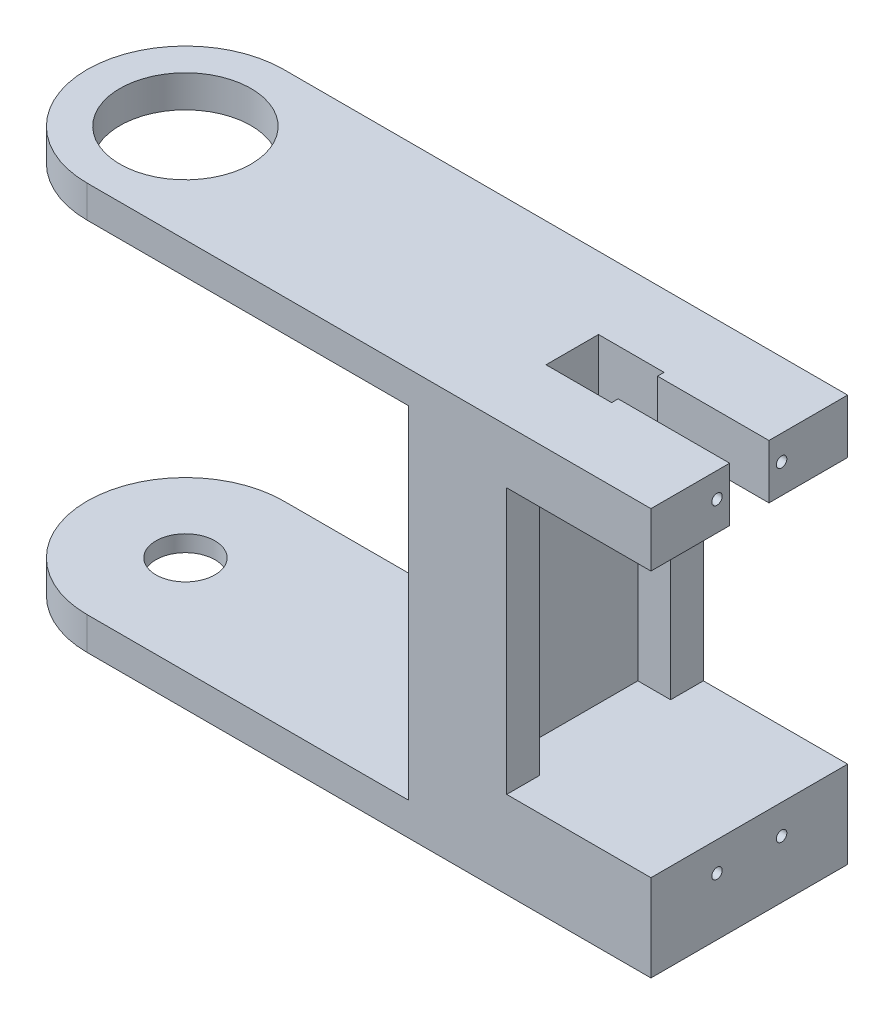
from build123d import *

# Parameters (mm, degrees)
ESQUISSE1_W               = 60.5
ESQUISSE1_H               = 64
BOSS_EXTRU_1_DEPTH        = 30
ESQUISSE2_R               = 4.5
ENL_V_MAT_EXTRU_1_DEPTH   = 32
ENL_V_MAT_EXTRU_2_REACH   = 55.283
ESQUISSE4_W               = 51.1
ESQUISSE4_H               = 83.557669167
ESQUISSE5_R               = 10.5
ENL_V_MAT_EXTRU_3_DEPTH   = 2
ESQUISSE6_R               = 10
ENL_V_MAT_EXTRU_4_DEPTH   = 4.7
ESQUISSE7_W               = 47
ESQUISSE7_H               = 57
BOSS_EXTRU_2_DEPTH        = 30
ENL_V_MAT_EXTRU_5_DEPTH   = 30
ENL_V_MAT_EXTRU_6_DEPTH   = 8.25
ESQUISSE11_W              = 5
ESQUISSE11_H              = 40.5
BOSS_EXTRU_3_DEPTH        = 5
ESQUISSE12_R              = 0.5
ENL_V_MAT_EXTRU_7_DEPTH   = 15
TROU_TARAUD_M2X0_42_D     = 1.6
TROU_TARAUD_M2X0_42_DEPTH = 17
TROU_TARAUD_M2X0_42_TIP   = 0.480688495
ENL_V_MAT_EXTRU_8_REACH   = 113.72
ESQUISSE22_W              = 82.97203866
ESQUISSE22_H              = 67.875780224
ENL_V_MAT_EXTRU_10_DEPTH  = 30
ESQUISSE23_W              = 55
ESQUISSE23_H              = 5
ESQUISSE23_H_2            = 4.9
BOSS_EXTRU_4_DEPTH        = 30
ENL_V_START               = -62
ESQUISSE24_R              = 10
ENL_V_MAT_EXTRU_11_DEPTH  = 62
ENL_V_MAT_EXTRU_12_REACH  = 111.597
ESQUISSE26_R              = 10.5
ESQUISSE26_R_2            = 4.5
BOSS_EXTRU_5_DEPTH        = 5
ESQUISSE27_R              = 10.5
ENL_V_MAT_EXTRU_13_DEPTH  = 2.5
ESQUISSE28_W              = 21.53784572
ESQUISSE28_H              = 33.22443827
ENL_V_MAT_EXTRU_14_DEPTH  = 5
ESQUISSE29_W              = 5
ESQUISSE29_H              = 52.1
ENL_V_MAT_EXTRU_15_DEPTH  = 30
BOSS_EXTRU_6_DEPTH        = 62
ENL_V_START_2             = -20.388398
ESQUISSE32_W              = 38.789198293
ESQUISSE32_H              = 52.1
ENL_V_MAT_EXTRU_16_DEPTH  = 20.388398


with BuildPart() as part:
    # Esquisse1 → Boss.-Extru.1 (new body)
    with BuildSketch(Plane.XY):
        Rectangle(ESQUISSE1_W, ESQUISSE1_H)
    extrude(amount=BOSS_EXTRU_1_DEPTH)

    # Esquisse2 → Enlèv. mat.-Extru.1 (cut)
    with BuildSketch(Plane(origin=(30.25, 0, 0), x_dir=(0, 0, -1), z_dir=(1, 0, 0))):
        with Locations(Location((-15, -17, 0), (0, 0, 90))):
            Circle(ESQUISSE2_R)
    extrude(amount=-ENL_V_MAT_EXTRU_1_DEPTH, mode=Mode.SUBTRACT)

    # Enlèv. mat.-Extru.2: up to this face of the body (flat: up to its plane)
    enl_v_mat_extru_2_end = Plane(part.part.faces().sort_by_distance((0, 0, 0))[0])
    # Esquisse4 → Enlèv. mat.-Extru.2 (cut, up to the picked face)
    with BuildSketch(Plane.XY.offset(30), mode=Mode.PRIVATE) as enl_v_mat_extru_2_sk1:
        with Locations((0, -14.778834584)):
            Rectangle(ESQUISSE4_W, ESQUISSE4_H)
    enl_v_mat_extru_2_tool1 = split(extrude(enl_v_mat_extru_2_sk1.sketch, amount=-ENL_V_MAT_EXTRU_2_REACH, mode=Mode.PRIVATE), bisect_by=enl_v_mat_extru_2_end, keep=Keep.BOTH, mode=Mode.PRIVATE)
    add(enl_v_mat_extru_2_tool1.solids().sort_by(Axis((0, -14.778835, 30), (0, 0, -1)))[0], mode=Mode.SUBTRACT)

    # Esquisse5 → Enlèv. mat.-Extru.3 (cut)
    with BuildSketch(Plane(origin=(30.25, 0, 0), x_dir=(0, 0, -1), z_dir=(1, 0, 0))):
        with Locations(Location((-15, -17, 0), (0, 0, 90))):
            Circle(ESQUISSE5_R)
    extrude(amount=-ENL_V_MAT_EXTRU_3_DEPTH, mode=Mode.SUBTRACT)

    # Esquisse6 → Enlèv. mat.-Extru.4 (cut)
    with BuildSketch(Plane(origin=(-25.55, 0, 0), x_dir=(0, 0, -1), z_dir=(1, 0, 0))):
        with Locations((-15, -17)):
            Circle(ESQUISSE6_R)
    extrude(amount=-ENL_V_MAT_EXTRU_4_DEPTH, mode=Mode.SUBTRACT)

    # Esquisse7 → Boss.-Extru.2 (add)
    with BuildSketch(Plane.XY.offset(30)):
        with Locations((-6.75, 60.5)):
            Rectangle(ESQUISSE7_W, ESQUISSE7_H)
    extrude(amount=-BOSS_EXTRU_2_DEPTH)

    # Esquisse8 → Enlèv. mat.-Extru.5 (cut)
    with BuildSketch(Plane.XY.offset(30)):
        Polygon((-15.25, 80.75), (11.75, 80.75), (11.75, 101.149817475), (21.75, 101.149817475), (21.75, 32), (11.75, 32), (11.75, 40.25), (-15.25, 40.25), align=None)
    extrude(amount=-ENL_V_MAT_EXTRU_5_DEPTH, mode=Mode.SUBTRACT)

    # Esquisse10 → Enlèv. mat.-Extru.6 (cut)
    with BuildSketch(Plane.XZ.offset(-80.75)):
        Polygon((-5.25, 11), (-5.25, 12), (34.75, 12), (34.75, 18), (-5.25, 18), (-5.25, 19), (-15.25, 19), (-15.25, 11), align=None)
    extrude(amount=-ENL_V_MAT_EXTRU_6_DEPTH, mode=Mode.SUBTRACT)

    # Esquisse11 → Boss.-Extru.3 (add)
    with BuildSketch(Plane(origin=(-15.25, 0, 0), x_dir=(0, 0, -1), z_dir=(1, 0, 0))):
        with Locations((-27.5, 60.5)):
            Rectangle(ESQUISSE11_W, ESQUISSE11_H)
        with Locations((-2.5, 60.5)):
            Rectangle(ESQUISSE11_W, ESQUISSE11_H)
    extrude(amount=BOSS_EXTRU_3_DEPTH)

    # Esquisse12 → Enlèv. mat.-Extru.7 (cut)
    with BuildSketch(Plane(origin=(11.75, 0, 0), x_dir=(0, 0, -1), z_dir=(1, 0, 0))):
        with Locations((-19.925, 85.21)):
            Circle(ESQUISSE12_R)
        with Locations(Location((-10.075, 85.21, 0), (0, 0, 180))):
            Circle(ESQUISSE12_R)
        with Locations((-10.075, 35.79)):
            Circle(ESQUISSE12_R)
        with Locations(Location((-19.925, 35.79, 0), (0, 0, 180))):
            Circle(ESQUISSE12_R)
    extrude(amount=-ENL_V_MAT_EXTRU_7_DEPTH, mode=Mode.SUBTRACT)

    # Trou taraudé M2x0.42
    with Locations(Plane(origin=(11.75, 85.21, 19.925), x_dir=(0, 0, 1), z_dir=(1, 0, 0))):
        with Locations((0, 0), (-9.85, 0), (-9.85, 49.42), (0, 49.42)):
            Hole(TROU_TARAUD_M2X0_42_D / 2, depth=TROU_TARAUD_M2X0_42_DEPTH)
            with Locations((0, 0, -(TROU_TARAUD_M2X0_42_DEPTH + TROU_TARAUD_M2X0_42_TIP / 2))):  # 118° drill point
                Cone(0, TROU_TARAUD_M2X0_42_D / 2, TROU_TARAUD_M2X0_42_TIP, mode=Mode.SUBTRACT)

    # Enlèv. mat.-Extru.8: up to this face of the body (flat: up to its plane)
    enl_v_mat_extru_8_end = Plane(part.part.faces().sort_by_distance((30.25, 3.741727612, 15))[0])
    # Esquisse15 → Enlèv. mat.-Extru.8 (cut, up to the picked face)
    with BuildSketch(Plane.ZY.offset(30.25), mode=Mode.PRIVATE) as enl_v_mat_extru_8_sk1:
        with BuildLine():
            Line((40, -17), (30, -17))
            ThreePointArc((30, -17), (15, -32), (0, -17))
            Line((0, -17), (-10, -17))
            ThreePointArc((-10, -17), (15, -42), (40, -17))
        make_face()
    enl_v_mat_extru_8_tool1 = split(extrude(enl_v_mat_extru_8_sk1.sketch, amount=-ENL_V_MAT_EXTRU_8_REACH, mode=Mode.PRIVATE), bisect_by=enl_v_mat_extru_8_end, keep=Keep.BOTH, mode=Mode.PRIVATE)
    add(enl_v_mat_extru_8_tool1.solids().sort_by(Axis((-30.25, -17.559017, -5), (1, 0, 0)))[0], mode=Mode.SUBTRACT)

    # Esquisse22 → Enlèv. mat.-Extru.10 (cut)
    with BuildSketch(Plane.XY.offset(30)):
        with Locations((-1.917421061, -6.937890112)):
            Rectangle(ESQUISSE22_W, ESQUISSE22_H)
    extrude(amount=-ENL_V_MAT_EXTRU_10_DEPTH, mode=Mode.SUBTRACT)

    # Esquisse23 → Boss.-Extru.4 (add)
    with BuildSketch(Plane(origin=(0, 0, 0), x_dir=(-1, 0, 0), z_dir=(0, 0, -1))):
        with Locations((57.75, 29.5)):
            Rectangle(ESQUISSE23_W, ESQUISSE23_H)
        with Locations((57.75, 86.55)):
            Rectangle(ESQUISSE23_W, ESQUISSE23_H_2)
    extrude(amount=-BOSS_EXTRU_4_DEPTH)

    # Esquisse24 → Enlèv. mat.-Extru.11 (cut)
    with BuildSketch(Plane.XZ.offset(-27).offset(ENL_V_START)):
        with Locations((-74.25, 15)):
            Circle(ESQUISSE24_R)
    extrude(amount=ENL_V_MAT_EXTRU_11_DEPTH, mode=Mode.SUBTRACT)

    # Enlèv. mat.-Extru.12: up to this face of the body (flat: up to its plane)
    enl_v_mat_extru_12_end = Plane(part.part.faces().sort_by_distance((-34.437928466, 89, 15))[0])
    # Esquisse25 → Enlèv. mat.-Extru.12 (cut, up to the picked face)
    with BuildSketch(Plane.XZ.offset(-27), mode=Mode.PRIVATE) as enl_v_mat_extru_12_sk1:
        with BuildLine():
            Line((-74.25, 44.134833893), (-74.25, 30))
            ThreePointArc((-74.25, 30), (-89.25, 15), (-74.25, 0))
            Line((-74.25, 0), (-74.25, -14.134833893))
            ThreePointArc((-74.25, -14.134833893), (-103.384833893, 15), (-74.25, 44.134833893))
        make_face()
    enl_v_mat_extru_12_tool1 = split(extrude(enl_v_mat_extru_12_sk1.sketch, amount=-ENL_V_MAT_EXTRU_12_REACH, mode=Mode.PRIVATE), bisect_by=enl_v_mat_extru_12_end, keep=Keep.BOTH, mode=Mode.PRIVATE)
    add(enl_v_mat_extru_12_tool1.solids().sort_by(Axis((-74.901475, 27, 37.067417), (0, 1, 0)))[0], mode=Mode.SUBTRACT)

    # Esquisse26 → Boss.-Extru.5 (add)
    with BuildSketch(Plane.XZ.offset(-27)):
        with Locations((-74.25, 15)):
            Circle(ESQUISSE26_R)
        with Locations((-74.25, 15)):
            Circle(ESQUISSE26_R_2, mode=Mode.SUBTRACT)
    extrude(amount=-BOSS_EXTRU_5_DEPTH)

    # Esquisse27 → Enlèv. mat.-Extru.13 (cut)
    with BuildSketch(Plane.XZ.offset(-27)):
        with Locations((-74.25, 15)):
            Circle(ESQUISSE27_R)
    extrude(amount=-ENL_V_MAT_EXTRU_13_DEPTH, mode=Mode.SUBTRACT)

    # Esquisse28 → Enlèv. mat.-Extru.14 (cut)
    with BuildSketch(Plane(origin=(0, 32, 0), x_dir=(1, 0, 0), z_dir=(0, 1, 0))):
        with Locations((22.51892286, -16.612219135)):
            Rectangle(ESQUISSE28_W, ESQUISSE28_H)
    extrude(amount=-ENL_V_MAT_EXTRU_14_DEPTH, mode=Mode.SUBTRACT)

    # Esquisse29 → Enlèv. mat.-Extru.15 (cut)
    with BuildSketch(Plane(origin=(0, 0, 0), x_dir=(-1, 0, 0), z_dir=(0, 0, -1))):
        with Locations((27.75, 58.05)):
            Rectangle(ESQUISSE29_W, ESQUISSE29_H)
    extrude(amount=-ENL_V_MAT_EXTRU_15_DEPTH, mode=Mode.SUBTRACT)

    # Esquisse31 → Boss.-Extru.6 (add)
    with BuildSketch(Plane.XZ.offset(-27)):
        with BuildLine():
            ThreePointArc((-74.826036871, 4.515812787), (-83.84709586, 10.740217019), (-82.411654216, 21.605861069))
            Line((-82.411654216, 21.605861069), (-85.25, 25.198039027))
            Line((-85.25, 25.198039027), (-85.25, 4.801960973))
            Line((-85.25, 4.801960973), (-74.826036871, 4.515812787))
        make_face()
        with BuildLine():
            ThreePointArc((-85.25, 25.198039027), (-89.25, 15), (-85.25, 4.801960973))
            Line((-85.25, 4.801960973), (-85.25, 25.198039027))
        make_face()
    extrude(amount=-BOSS_EXTRU_6_DEPTH)

    # Esquisse32 → Enlèv. mat.-Extru.16 (cut)
    with BuildSketch(Plane(origin=(0.067526976, 0, 2.459909751), x_dir=(-0.9996234341769173, 0, 0.027440660421105302), z_dir=(-0.027440660421105302, 0, -0.9996234341769173)).offset(ENL_V_START_2)):
        with Locations((94.316375975, 58.05)):
            Rectangle(ESQUISSE32_W, ESQUISSE32_H)
    extrude(amount=ENL_V_MAT_EXTRU_16_DEPTH, mode=Mode.SUBTRACT)


solid = part.part
